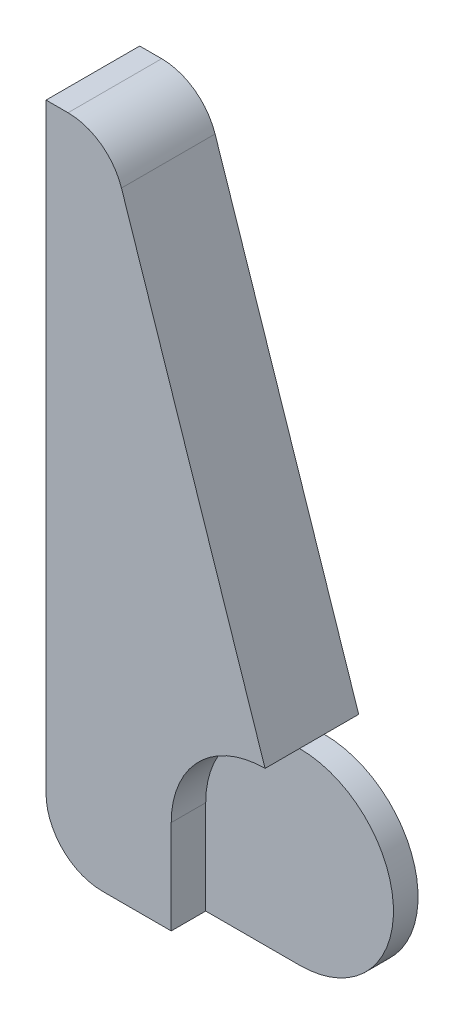
from build123d import *

# Parameters (mm, degrees)
BOSS_EXTRUDE2_DEPTH      = 19
BOSS_EXTRUDE2_DEPTH_BACK = 19
CUT_EXTRUDE2_START       = -14
CUT_EXTRUDE2_DEPTH       = 14


with BuildPart() as part:
    # Sketch3 → Boss-Extrude2 (new, two sides: drawn at the far end of the back side and taken through both)
    with BuildSketch(Plane.XY.offset(-BOSS_EXTRUDE2_DEPTH_BACK)):
        with BuildLine():
            Line((0, -38.1), (-66.04, -38.1))
            ThreePointArc((-66.04, -38.1), (-82.204461018, -31.404461018), (-88.9, -15.24))
            Line((-88.9, -15.24), (-88.9, 228.6))
            Line((-88.9, 228.6), (-79.97655577, 228.6))
            ThreePointArc((-79.97655577, 228.6), (-66.610078663, 224.284996353), (-58.289655577, 212.968966731))
            Line((-58.289655577, 212.968966731), (0, 38.1))
            ThreePointArc((0, 38.1), (38.1, 0), (0, -38.1))
        make_face()
    extrude(amount=BOSS_EXTRUDE2_DEPTH + BOSS_EXTRUDE2_DEPTH_BACK)

    # Sketch5 → Cut-Extrude2 (cut)
    with BuildSketch(Plane.XY.offset(19).offset(CUT_EXTRUDE2_START)):
        with BuildLine():
            Line((-38.1, 0), (-38.1, -38.1))
            Line((-38.1, -38.1), (0, -38.1))
            ThreePointArc((0, -38.1), (26.940768363, 26.940768363), (-38.1, 0))
        make_face()
    cut_extrude2 = extrude(amount=CUT_EXTRUDE2_DEPTH, mode=Mode.SUBTRACT)

    # Mirror2: Cut-Extrude2 across plane
    add(cut_extrude2.mirror(Plane.XY), mode=Mode.SUBTRACT)


solid = part.part
